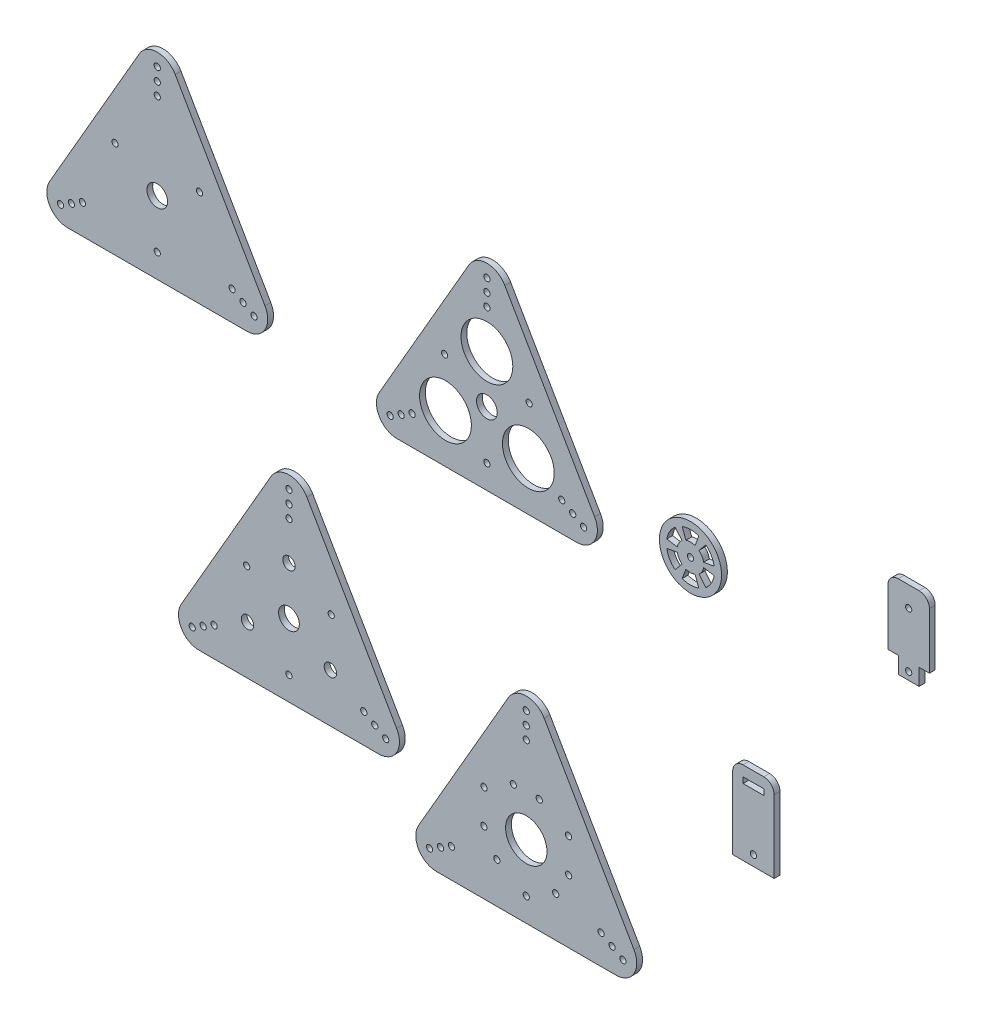
from build123d import *

# Parameters (mm, degrees)
WHEEL_R             = 1.5
BOSS_EXTRUDE1_DEPTH = 2.8
SKETCH2_R           = 1.5
SKETCH2_R_2         = 3
SKETCH2_R_3         = 5
BOSS_EXTRUDE2_DEPTH = 2.8
SKETCH3_R           = 1.5
SKETCH3_R_2         = 5
BOSS_EXTRUDE3_DEPTH = 2.8
SKETCH4_R           = 1.5
SKETCH4_R_2         = 10
BOSS_EXTRUDE4_DEPTH = 2.8
SKETCH5_R           = 12.5
SKETCH5_R_2         = 1.5
SKETCH5_R_3         = 5
BOSS_EXTRUDE5_DEPTH = 2.8
SKETCH6_R           = 1.5
BOSS_EXTRUDE6_DEPTH = 2.8
SKETCH7_R           = 15
SKETCH7_R_2         = 1.5
BOSS_EXTRUDE7_DEPTH = 2.8


with BuildPart() as part:
    # wheel → Boss-Extrude1 (new body)
    with BuildSketch(Plane.XY):
        with BuildLine():
            Line((294.016315947, 151.094134866), (304.016315947, 151.094134866))
            ThreePointArc((304.016315947, 151.094134866), (307.551849853, 149.629668772), (309.016315947, 146.094134866))
            Line((309.016315947, 146.094134866), (309.016315947, 119.094134866))
            Line((309.016315947, 119.094134866), (304.016315947, 119.094134866))
            Line((304.016315947, 119.094134866), (304.016315947, 111.094134866))
            Line((304.016315947, 111.094134866), (299.016315947, 111.094134866))
            Line((299.016315947, 111.094134866), (294.016315947, 111.094134866))
            Line((294.016315947, 111.094134866), (294.016315947, 119.094134866))
            Line((294.016315947, 119.094134866), (289.016315947, 119.094134866))
            Line((289.016315947, 119.094134866), (289.016315947, 146.094134866))
            ThreePointArc((289.016315947, 146.094134866), (290.480782041, 149.629668772), (294.016315947, 151.094134866))
        make_face()
        with Locations((299.016315947, 114.794134866)):
            Circle(WHEEL_R, mode=Mode.SUBTRACT)
        with Locations((299.016315947, 141.254134866)):
            Circle(WHEEL_R, mode=Mode.SUBTRACT)
    extrude(amount=BOSS_EXTRUDE1_DEPTH)


with BuildPart() as body_2:
    # Sketch2 → Boss-Extrude2 (new body)
    with BuildSketch(Plane.XY):
        with BuildLine():
            Line((-8.660254038, 42.5), (-51.961524227, -32.5))
            ThreePointArc((-51.961524227, -32.5), (-51.961524227, -42.5), (-43.301270189, -47.5))
            Line((-43.301270189, -47.5), (43.301270189, -47.5))
            ThreePointArc((43.301270189, -47.5), (51.961524227, -42.5), (51.961524227, -32.5))
            Line((51.961524227, -32.5), (8.660254038, 42.5))
            ThreePointArc((8.660254038, 42.5), (0, 47.5), (-8.660254038, 42.5))
        make_face()
        with Locations((0, -36.045)):
            Circle(SKETCH2_R, mode=Mode.SUBTRACT)
        with Locations((20.390568132, -0.7275)):
            Circle(SKETCH2_R, mode=Mode.SUBTRACT)
        with Locations((-20.390568132, -0.7275)):
            Circle(SKETCH2_R, mode=Mode.SUBTRACT)
        with Locations((0, 41.3975)):
            Circle(SKETCH2_R, mode=Mode.SUBTRACT)
        with Locations((0, 35.295)):
            Circle(SKETCH2_R, mode=Mode.SUBTRACT)
        with Locations((0, 29.1925)):
            Circle(SKETCH2_R, mode=Mode.SUBTRACT)
        with Locations((-46.6766042, -39.44875)):
            Circle(SKETCH2_R, mode=Mode.SUBTRACT)
        with Locations((-41.391684174, -36.3975)):
            Circle(SKETCH2_R, mode=Mode.SUBTRACT)
        with Locations((-36.106764147, -33.34625)):
            Circle(SKETCH2_R, mode=Mode.SUBTRACT)
        with Locations((46.6766042, -39.44875)):
            Circle(SKETCH2_R, mode=Mode.SUBTRACT)
        with Locations((41.391684174, -36.3975)):
            Circle(SKETCH2_R, mode=Mode.SUBTRACT)
        with Locations((36.106764147, -33.34625)):
            Circle(SKETCH2_R, mode=Mode.SUBTRACT)
        with Locations((0, 10.59)):
            Circle(SKETCH2_R_2, mode=Mode.SUBTRACT)
        with Locations((-19.996526573, -24.045)):
            Circle(SKETCH2_R_2, mode=Mode.SUBTRACT)
        with Locations((19.996526573, -24.045)):
            Circle(SKETCH2_R_2, mode=Mode.SUBTRACT)
        with Locations((0, -12.5)):
            Circle(SKETCH2_R_3, mode=Mode.SUBTRACT)
    extrude(amount=BOSS_EXTRUDE2_DEPTH)


with BuildPart() as body_3:
    # Sketch3 → Boss-Extrude3 (new body)
    with BuildSketch(Plane.XY):
        with BuildLine():
            Line((-72.203502102, 187.347932617), (-115.504772291, 112.347932617))
            ThreePointArc((-115.504772291, 112.347932617), (-115.504772291, 102.347932617), (-106.844518253, 97.347932617))
            Line((-106.844518253, 97.347932617), (-20.241977875, 97.347932617))
            ThreePointArc((-20.241977875, 97.347932617), (-11.581723837, 102.347932617), (-11.581723837, 112.347932617))
            Line((-11.581723837, 112.347932617), (-54.882994026, 187.347932617))
            ThreePointArc((-54.882994026, 187.347932617), (-63.543248064, 192.347932617), (-72.203502102, 187.347932617))
        make_face()
        with Locations((-63.543248064, 108.802932617)):
            Circle(SKETCH3_R, mode=Mode.SUBTRACT)
        with Locations((-43.152679932, 144.120432617)):
            Circle(SKETCH3_R, mode=Mode.SUBTRACT)
        with Locations((-83.933816196, 144.120432617)):
            Circle(SKETCH3_R, mode=Mode.SUBTRACT)
        with Locations((-63.543248064, 186.245432617)):
            Circle(SKETCH3_R, mode=Mode.SUBTRACT)
        with Locations((-63.543248064, 180.142932617)):
            Circle(SKETCH3_R, mode=Mode.SUBTRACT)
        with Locations((-63.543248064, 174.040432617)):
            Circle(SKETCH3_R, mode=Mode.SUBTRACT)
        with Locations((-110.219852264, 105.399182617)):
            Circle(SKETCH3_R, mode=Mode.SUBTRACT)
        with Locations((-104.934932238, 108.450432617)):
            Circle(SKETCH3_R, mode=Mode.SUBTRACT)
        with Locations((-99.650012211, 111.501682617)):
            Circle(SKETCH3_R, mode=Mode.SUBTRACT)
        with Locations((-16.866643864, 105.399182617)):
            Circle(SKETCH3_R, mode=Mode.SUBTRACT)
        with Locations((-22.15156389, 108.450432617)):
            Circle(SKETCH3_R, mode=Mode.SUBTRACT)
        with Locations((-27.436483917, 111.501682617)):
            Circle(SKETCH3_R, mode=Mode.SUBTRACT)
        with Locations((-63.543248064, 132.347932617)):
            Circle(SKETCH3_R_2, mode=Mode.SUBTRACT)
    extrude(amount=BOSS_EXTRUDE3_DEPTH)


with BuildPart() as body_4:
    # Sketch4 → Boss-Extrude4 (new body)
    with BuildSketch(Plane.XY):
        with BuildLine():
            Line((105.848817323, 7.323055953), (62.547547134, -67.676944047))
            ThreePointArc((62.547547134, -67.676944047), (62.547547134, -77.676944047), (71.207801171, -82.676944047))
            Line((71.207801171, -82.676944047), (157.81034155, -82.676944047))
            ThreePointArc((157.81034155, -82.676944047), (166.470595588, -77.676944047), (166.470595588, -67.676944047))
            Line((166.470595588, -67.676944047), (123.169325398, 7.323055953))
            ThreePointArc((123.169325398, 7.323055953), (114.509071361, 12.323055953), (105.848817323, 7.323055953))
        make_face()
        with Locations((114.509071361, -71.221944047)):
            Circle(SKETCH4_R, mode=Mode.SUBTRACT)
        with Locations((134.899639493, -35.904444047)):
            Circle(SKETCH4_R, mode=Mode.SUBTRACT)
        with Locations((94.118503229, -35.904444047)):
            Circle(SKETCH4_R, mode=Mode.SUBTRACT)
        with Locations((114.509071361, 6.220555953)):
            Circle(SKETCH4_R, mode=Mode.SUBTRACT)
        with Locations((114.509071361, 0.118055953)):
            Circle(SKETCH4_R, mode=Mode.SUBTRACT)
        with Locations((114.509071361, -5.984444047)):
            Circle(SKETCH4_R, mode=Mode.SUBTRACT)
        with Locations((67.83246716, -74.625694047)):
            Circle(SKETCH4_R, mode=Mode.SUBTRACT)
        with Locations((73.117387187, -71.574444047)):
            Circle(SKETCH4_R, mode=Mode.SUBTRACT)
        with Locations((78.402307213, -68.523194047)):
            Circle(SKETCH4_R, mode=Mode.SUBTRACT)
        with Locations((161.185675561, -74.625694047)):
            Circle(SKETCH4_R, mode=Mode.SUBTRACT)
        with Locations((155.900755535, -71.574444047)):
            Circle(SKETCH4_R, mode=Mode.SUBTRACT)
        with Locations((150.615835508, -68.523194047)):
            Circle(SKETCH4_R, mode=Mode.SUBTRACT)
        with Locations((108.259071361, -27.676944047)):
            Circle(SKETCH4_R, mode=Mode.SUBTRACT)
        with Locations((120.759071361, -27.676944047)):
            Circle(SKETCH4_R, mode=Mode.SUBTRACT)
        with Locations((100.313563285, -63.089602821)):
            Circle(SKETCH4_R, mode=Mode.SUBTRACT)
        with Locations((94.063563285, -52.264285274)):
            Circle(SKETCH4_R, mode=Mode.SUBTRACT)
        with Locations((134.954579436, -52.264285274)):
            Circle(SKETCH4_R, mode=Mode.SUBTRACT)
        with Locations((128.704579436, -63.089602821)):
            Circle(SKETCH4_R, mode=Mode.SUBTRACT)
        with Locations((114.509071361, -47.676944047)):
            Circle(SKETCH4_R_2, mode=Mode.SUBTRACT)
    extrude(amount=BOSS_EXTRUDE4_DEPTH)


with BuildPart() as body_5:
    # Sketch5 → Boss-Extrude5 (new body)
    with BuildSketch(Plane.XY):
        with BuildLine():
            Line((86.851002652, 178.685110954), (43.549732462, 103.685110954))
            ThreePointArc((43.549732462, 103.685110954), (43.549732462, 93.685110954), (52.2099865, 88.685110954))
            Line((52.2099865, 88.685110954), (138.812526879, 88.685110954))
            ThreePointArc((138.812526879, 88.685110954), (147.472780917, 93.685110954), (147.472780917, 103.685110954))
            Line((147.472780917, 103.685110954), (104.171510727, 178.685110954))
            ThreePointArc((104.171510727, 178.685110954), (95.511256689, 183.685110954), (86.851002652, 178.685110954))
        make_face()
        with Locations((95.511256689, 146.775110954)):
            Circle(SKETCH5_R, mode=Mode.SUBTRACT)
        with Locations((75.514730116, 112.140110954)):
            Circle(SKETCH5_R, mode=Mode.SUBTRACT)
        with Locations((115.507783263, 112.140110954)):
            Circle(SKETCH5_R, mode=Mode.SUBTRACT)
        with Locations((95.511256689, 100.140110954)):
            Circle(SKETCH5_R_2, mode=Mode.SUBTRACT)
        with Locations((115.901824822, 135.457610954)):
            Circle(SKETCH5_R_2, mode=Mode.SUBTRACT)
        with Locations((75.120688557, 135.457610954)):
            Circle(SKETCH5_R_2, mode=Mode.SUBTRACT)
        with Locations((95.511256689, 177.582610954)):
            Circle(SKETCH5_R_2, mode=Mode.SUBTRACT)
        with Locations((95.511256689, 171.480110954)):
            Circle(SKETCH5_R_2, mode=Mode.SUBTRACT)
        with Locations((95.511256689, 165.377610954)):
            Circle(SKETCH5_R_2, mode=Mode.SUBTRACT)
        with Locations((48.834652489, 96.736360954)):
            Circle(SKETCH5_R_2, mode=Mode.SUBTRACT)
        with Locations((54.119572516, 99.787610954)):
            Circle(SKETCH5_R_2, mode=Mode.SUBTRACT)
        with Locations((59.404492542, 102.838860954)):
            Circle(SKETCH5_R_2, mode=Mode.SUBTRACT)
        with Locations((142.18786089, 96.736360954)):
            Circle(SKETCH5_R_2, mode=Mode.SUBTRACT)
        with Locations((136.902940863, 99.787610954)):
            Circle(SKETCH5_R_2, mode=Mode.SUBTRACT)
        with Locations((131.618020837, 102.838860954)):
            Circle(SKETCH5_R_2, mode=Mode.SUBTRACT)
        with Locations((95.511256689, 123.685110954)):
            Circle(SKETCH5_R_3, mode=Mode.SUBTRACT)
    extrude(amount=BOSS_EXTRUDE5_DEPTH)


with BuildPart() as body_6:
    # Sketch6 → Boss-Extrude6 (new body)
    with BuildSketch(Plane.XY):
        with BuildLine():
            Line((214.11184831, -4.134381964), (234.11184831, -4.134381964))
            Line((234.11184831, -4.134381964), (234.11184831, 30.865618036))
            ThreePointArc((234.11184831, 30.865618036), (232.647382216, 34.401151942), (229.11184831, 35.865618036))
            Line((229.11184831, 35.865618036), (219.11184831, 35.865618036))
            ThreePointArc((219.11184831, 35.865618036), (215.576314404, 34.401151942), (214.11184831, 30.865618036))
            Line((214.11184831, 30.865618036), (214.11184831, -4.134381964))
        make_face()
        with Locations((224.11184831, 0.865618036)):
            Circle(SKETCH6_R, mode=Mode.SUBTRACT)
        Polygon((224.11184831, 30.865618036), (219.11184831, 30.865618036), (219.11184831, 28.065618036), (229.11184831, 28.065618036), (229.11184831, 30.865618036), align=None, mode=Mode.SUBTRACT)
    extrude(amount=BOSS_EXTRUDE6_DEPTH)


with BuildPart() as body_7:
    # Sketch7 → Boss-Extrude7 (new body)
    with BuildSketch(Plane.XY):
        with Locations((193.744947861, 109.903151878)):
            Circle(SKETCH7_R)
        with Locations((193.744947861, 109.903151878)):
            Circle(SKETCH7_R_2, mode=Mode.SUBTRACT)
        with BuildLine():
            Line((182.326206818, 111.881239005), (187.415034832, 110.999693032))
            ThreePointArc((187.415034832, 110.999693032), (188.181819844, 113.11590897), (189.631534347, 114.837726908))
            Line((189.631534347, 114.837726908), (186.324624154, 118.804796208))
            ThreePointArc((186.324624154, 118.804796208), (183.709435854, 115.698751454), (182.326206818, 111.881239005))
        make_face(mode=Mode.SUBTRACT)
        with BuildLine():
            Line((182.325735883, 107.927785209), (187.414773771, 108.808118794))
            ThreePointArc((187.414773771, 108.808118794), (188.181054595, 106.691720238), (189.630358851, 104.969556968))
            Line((189.630358851, 104.969556968), (186.322503637, 101.00327562))
            ThreePointArc((186.322503637, 101.00327562), (183.708055395, 104.109943328), (182.325735883, 107.927785209))
        make_face(mode=Mode.SUBTRACT)
        with BuildLine():
            Line((189.746059589, 99.026140879), (191.528187285, 103.873543765))
            ThreePointArc((191.528187285, 103.873543765), (193.744182611, 103.478963146), (195.96027188, 103.873015815))
            Line((195.96027188, 103.873015815), (197.741244679, 99.025188493))
            ThreePointArc((197.741244679, 99.025188493), (193.743567402, 98.314343753), (189.746059589, 99.026140879))
        make_face(mode=Mode.SUBTRACT)
        with BuildLine():
            Line((201.165271567, 101.001507549), (197.858361374, 104.968576849))
            ThreePointArc((197.858361374, 104.968576849), (199.308075877, 106.690394787), (200.074860889, 108.806610725))
            Line((200.074860889, 108.806610725), (205.163688903, 107.925064752))
            ThreePointArc((205.163688903, 107.925064752), (203.780459867, 104.107552303), (201.165271567, 101.001507549))
        make_face(mode=Mode.SUBTRACT)
        with BuildLine():
            Line((205.164159838, 111.878518548), (200.07512195, 110.998184962))
            ThreePointArc((200.07512195, 110.998184962), (199.308841126, 113.114583519), (197.85953687, 114.836746788))
            Line((197.85953687, 114.836746788), (201.167392084, 118.803028137))
            ThreePointArc((201.167392084, 118.803028137), (203.781840326, 115.696360429), (205.164159838, 111.878518548))
        make_face(mode=Mode.SUBTRACT)
        with BuildLine():
            Line((197.743836132, 120.780162877), (195.961708436, 115.932759992))
            ThreePointArc((195.961708436, 115.932759992), (193.74571311, 116.327340611), (191.529623841, 115.933287942))
            Line((191.529623841, 115.933287942), (189.748651042, 120.781115264))
            ThreePointArc((189.748651042, 120.781115264), (193.746328319, 121.491960004), (197.743836132, 120.780162877))
        make_face(mode=Mode.SUBTRACT)
    extrude(amount=BOSS_EXTRUDE7_DEPTH)


solid = Compound([part.part, body_2.part, body_3.part, body_4.part, body_5.part, body_6.part, body_7.part])
